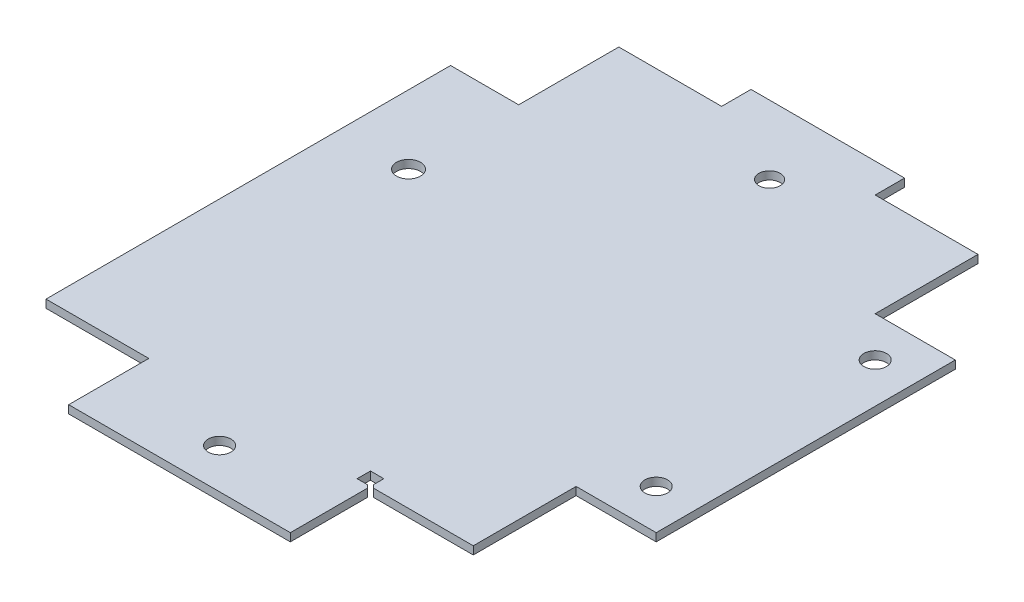
from build123d import *

# Parameters (mm, degrees)
CROQUIS1_W              = 190
CROQUIS1_H              = 230
SALIENTE_EXTRUIR2_DEPTH = 3
CROQUIS3_W              = 30
CROQUIS3_H              = 30
CORTAR_EXTRUIR1_DEPTH   = 10
CROQUIS5_W              = 38.5
CROQUIS5_H              = 30
CORTAR_EXTRUIR2_DEPTH   = 10
CROQUIS6_W              = 30
CROQUIS6_H              = 38.5
CORTAR_EXTRUIR3_DEPTH   = 10
CROQUIS7_W              = 38.5
CROQUIS7_H              = 30
CORTAR_EXTRUIR4_DEPTH   = 10
CORTAR_EXTRUIR12_DEPTH  = 10
CROQUIS11_W             = 5
CROQUIS11_H             = 5
CORTAR_EXTRUIR13_DEPTH  = 10
CORTAR_EXTRUIR14_DEPTH  = 10
CORTAR_EXTRUIR15_DEPTH  = 10
CORTAR_EXTRUIR16_DEPTH  = 10
CROQUIS15_W             = 30
CROQUIS15_H             = 38.5
CORTAR_EXTRUIR17_DEPTH  = 10
CROQUIS16_W             = 25.5
CROQUIS16_H             = 48.5
CORTAR_EXTRUIR18_DEPTH  = 10
CROQUIS17_W             = 24
CROQUIS17_H             = 11
CORTAR_EXTRUIR19_DEPTH  = 10
CROQUIS18_W             = 14.5
CROQUIS18_H             = 11
CORTAR_EXTRUIR20_DEPTH  = 10
CROQUIS19_R             = 4.25
CORTAR_EXTRUIR21_DEPTH  = 10
CROQUIS20_R             = 4.25
CORTAR_EXTRUIR22_DEPTH  = 10
CROQUIS21_R             = 4.5
CORTAR_EXTRUIR23_DEPTH  = 10
CROQUIS22_R             = 4
CORTAR_EXTRUIR24_DEPTH  = 10
CROQUIS23_W             = 30
CROQUIS23_H             = 38.5
CORTAR_EXTRUIR25_DEPTH  = 10
CROQUIS24_R             = 4.25
CORTAR_EXTRUIR26_DEPTH  = 10
SALIENTE_EXTRUIR4_DEPTH = 3
CROQUIS26_W             = 38.5
CROQUIS26_H             = 11
CORTAR_EXTRUIR27_DEPTH  = 30


with BuildPart() as part:
    # Croquis1 → Saliente-Extruir2 (new body)
    with BuildSketch(Plane(origin=(0, 0, 0), x_dir=(1, 0, 0), z_dir=(0, 1, 0))):
        Rectangle(CROQUIS1_W, CROQUIS1_H)
    extrude(amount=SALIENTE_EXTRUIR2_DEPTH)

    # Croquis3 → Cortar-Extruir1 (cut)
    with BuildSketch(Plane(origin=(0, 3, 0), x_dir=(1, 0, 0), z_dir=(0, 1, 0))):
        with Locations((80, -100)):
            Rectangle(CROQUIS3_W, CROQUIS3_H)
    extrude(amount=-CORTAR_EXTRUIR1_DEPTH, mode=Mode.SUBTRACT)

    # Croquis5 → Cortar-Extruir2 (cut)
    with BuildSketch(Plane(origin=(0, 3, 0), x_dir=(1, 0, 0), z_dir=(0, 1, 0))):
        with Locations((45.75, -100)):
            Rectangle(CROQUIS5_W, CROQUIS5_H)
    extrude(amount=-CORTAR_EXTRUIR2_DEPTH, mode=Mode.SUBTRACT)

    # Croquis6 → Cortar-Extruir3 (cut)
    with BuildSketch(Plane(origin=(0, 3, 0), x_dir=(1, 0, 0), z_dir=(0, 1, 0))):
        with Locations((80, -65.75)):
            Rectangle(CROQUIS6_W, CROQUIS6_H)
    extrude(amount=-CORTAR_EXTRUIR3_DEPTH, mode=Mode.SUBTRACT)

    # Croquis7 → Cortar-Extruir4 (cut)
    with BuildSketch(Plane(origin=(0, 3, 0), x_dir=(1, 0, 0), z_dir=(0, 1, 0))):
        with Locations((-75.75, -100)):
            Rectangle(CROQUIS7_W, CROQUIS7_H)
    extrude(amount=-CORTAR_EXTRUIR4_DEPTH, mode=Mode.SUBTRACT)

    # Croquis9 → Cortar-Extruir12 (cut)
    with BuildSketch(Plane(origin=(0, 3, 0), x_dir=(1, 0, 0), z_dir=(0, 1, 0))):
        Polygon((26.5, -85), (26.5, -85.75), (25.75, -85), (26.5, -84.25), (27.25, -85), align=None)
    extrude(amount=-CORTAR_EXTRUIR12_DEPTH, mode=Mode.SUBTRACT)

    # Croquis11 → Cortar-Extruir13 (cut)
    with BuildSketch(Plane(origin=(0, 3, 0), x_dir=(1, 0, 0), z_dir=(0, 1, 0))):
        with Locations((24, -82.5)):
            Rectangle(CROQUIS11_W, CROQUIS11_H)
    extrude(amount=-CORTAR_EXTRUIR13_DEPTH, mode=Mode.SUBTRACT)

    # Croquis12 → Cortar-Extruir14 (cut)
    with BuildSketch(Plane(origin=(0, 3, 0), x_dir=(1, 0, 0), z_dir=(0, 1, 0))):
        Polygon((26.5, -85.75), (25.75, -85), (25.573223305, -85.176776695), (26.323223305, -85.926776695), align=None)
    extrude(amount=-CORTAR_EXTRUIR14_DEPTH, mode=Mode.SUBTRACT)

    # Croquis13 → Cortar-Extruir15 (cut)
    with BuildSketch(Plane(origin=(0, 3, 0), x_dir=(1, 0, 0), z_dir=(0, 1, 0))):
        Polygon((26.5, -84.25), (27.25, -85), (27.426776695, -84.823223305), (26.676776695, -84.073223305), align=None)
    extrude(amount=-CORTAR_EXTRUIR15_DEPTH, mode=Mode.SUBTRACT)

    # Croquis14 → Cortar-Extruir16 (cut)
    with BuildSketch(Plane(origin=(0, 3, 0), x_dir=(1, 0, 0), z_dir=(0, 1, 0))):
        Polygon((25.573223305, -85.176776695), (25.75, -85), (25.002200766, -84.252200766), (24.82542407, -84.428977461), align=None)
        Polygon((26.323223305, -85.926776695), (26.5, -85.75), (26.914058622, -86.164058622), (26.737281927, -86.340835317), align=None)
        Polygon((27.426776695, -84.823223305), (27.25, -85), (27.599112283, -85.349112283), (27.775888978, -85.172335588), align=None)
        Polygon((26.676776695, -84.073223305), (26.5, -84.25), (26.076932461, -83.826932461), (26.253709156, -83.650155766), align=None)
    extrude(amount=-CORTAR_EXTRUIR16_DEPTH, mode=Mode.SUBTRACT)

    # Croquis15 → Cortar-Extruir17 (cut)
    with BuildSketch(Plane(origin=(0, 3, 0), x_dir=(1, 0, 0), z_dir=(0, 1, 0))):
        with Locations((80, 95.75)):
            Rectangle(CROQUIS15_W, CROQUIS15_H)
    extrude(amount=-CORTAR_EXTRUIR17_DEPTH, mode=Mode.SUBTRACT)

    # Croquis16 → Cortar-Extruir18 (cut)
    with BuildSketch(Plane(origin=(0, 3, 0), x_dir=(1, 0, 0), z_dir=(0, 1, 0))):
        with Locations((-82.25, 90.75)):
            Rectangle(CROQUIS16_W, CROQUIS16_H)
    extrude(amount=-CORTAR_EXTRUIR18_DEPTH, mode=Mode.SUBTRACT)

    # Croquis17 → Cortar-Extruir19 (cut)
    with BuildSketch(Plane(origin=(0, 3, 0), x_dir=(1, 0, 0), z_dir=(0, 1, 0))):
        with Locations((-57.5, 109.5)):
            Rectangle(CROQUIS17_W, CROQUIS17_H)
    extrude(amount=-CORTAR_EXTRUIR19_DEPTH, mode=Mode.SUBTRACT)

    # Croquis18 → Cortar-Extruir20 (cut)
    with BuildSketch(Plane(origin=(0, 3, 0), x_dir=(1, 0, 0), z_dir=(0, 1, 0))):
        with Locations((-38.25, 109.5)):
            Rectangle(CROQUIS18_W, CROQUIS18_H)
    extrude(amount=-CORTAR_EXTRUIR20_DEPTH, mode=Mode.SUBTRACT)

    # Croquis19 → Cortar-Extruir21 (cut)
    with BuildSketch(Plane(origin=(0, 3, 0), x_dir=(1, 0, 0), z_dir=(0, 1, 0))):
        with Locations(Location((80, 61.5, 0), (0, 0, 270))):
            Circle(CROQUIS19_R)
        with Locations(Location((80, -31.5, 0), (0, 0, 270))):
            Circle(CROQUIS19_R)
    extrude(amount=-CORTAR_EXTRUIR21_DEPTH, mode=Mode.SUBTRACT)

    # Croquis20 → Cortar-Extruir22 (cut)
    with BuildSketch(Plane(origin=(0, 3, 0), x_dir=(1, 0, 0), z_dir=(0, 1, 0))):
        with Locations(Location((-15, -100, 0), (0, 0, 270))):
            Circle(CROQUIS20_R)
    extrude(amount=-CORTAR_EXTRUIR22_DEPTH, mode=Mode.SUBTRACT)

    # Croquis21 → Cortar-Extruir23 (cut)
    with BuildSketch(Plane(origin=(0, 3, 0), x_dir=(1, 0, 0), z_dir=(0, 1, 0))):
        with Locations(Location((-69.25, 25, 0), (0, 0, 270))):
            Circle(CROQUIS21_R)
    extrude(amount=-CORTAR_EXTRUIR23_DEPTH, mode=Mode.SUBTRACT)

    # Croquis22 → Cortar-Extruir24 (cut)
    with BuildSketch(Plane(origin=(0, 3, 0), x_dir=(1, 0, 0), z_dir=(0, 1, 0))):
        with Locations(Location((1.7, 89.25, 0), (0, 0, 270))):
            Circle(CROQUIS22_R)
    extrude(amount=-CORTAR_EXTRUIR24_DEPTH, mode=Mode.SUBTRACT)

    # Croquis23 → Cortar-Extruir25 (cut)
    with BuildSketch(Plane(origin=(0, 3, 0), x_dir=(1, 0, 0), z_dir=(0, 1, 0))):
        with Locations((80, 84.75)):
            Rectangle(CROQUIS23_W, CROQUIS23_H)
    extrude(amount=-CORTAR_EXTRUIR25_DEPTH, mode=Mode.SUBTRACT)

    # Croquis24 → Cortar-Extruir26 (cut)
    with BuildSketch(Plane(origin=(0, 3, 0), x_dir=(1, 0, 0), z_dir=(0, 1, 0))):
        with Locations(Location((80, 50.5, 0), (0, 0, 270))):
            Circle(CROQUIS24_R)
    extrude(amount=-CORTAR_EXTRUIR26_DEPTH, mode=Mode.SUBTRACT)

    # Croquis25 → Saliente-Extruir4 (add)
    with BuildSketch(Plane(origin=(0, 3, 0), x_dir=(1, 0, 0), z_dir=(0, 1, 0))):
        with BuildLine():
            Line((78.563859338, 65.5), (81.436140662, 65.5))
            ThreePointArc((81.436140662, 65.5), (80, 57.25), (78.563859338, 65.5))
        make_face()
    extrude(amount=-SALIENTE_EXTRUIR4_DEPTH)

    # Croquis26 → Cortar-Extruir27 (cut)
    with BuildSketch(Plane(origin=(0, 3, 0), x_dir=(1, 0, 0), z_dir=(0, 1, 0))):
        with Locations((45.75, 109.5)):
            Rectangle(CROQUIS26_W, CROQUIS26_H)
    extrude(amount=-CORTAR_EXTRUIR27_DEPTH, mode=Mode.SUBTRACT)


solid = part.part
